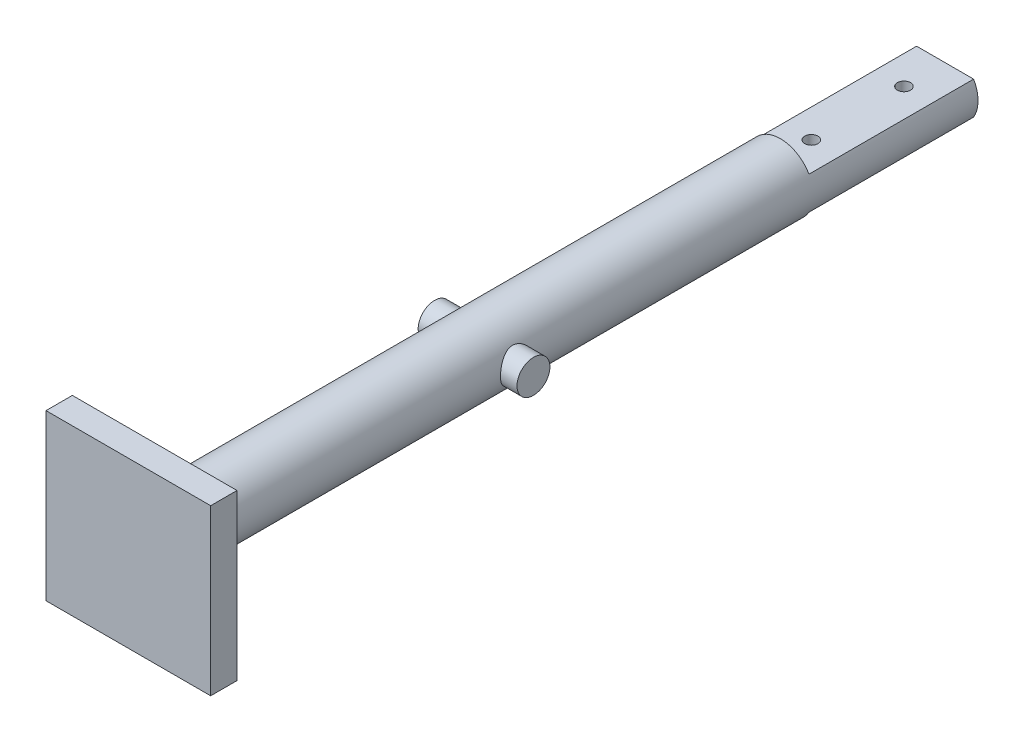
from build123d import *

# Parameters (mm, degrees)
SKETCH1_R           = 12.7
BOSS_EXTRUDE3_DEPTH = 152.4
SKETCH12_W          = 63.5
SKETCH12_H          = 63.5
BOSS_EXTRUDE5_DEPTH = 10.16
SKETCH9_R           = 6.35
BOSS_EXTRUDE6_DEPTH = 19.05
SKETCH16_W          = 25.4
SKETCH16_H          = 63.5
CUT_EXTRUDE2_DEPTH  = 170.957130183
SKETCH17_W          = 25.4
SKETCH17_H          = 63.5
CUT_EXTRUDE3_DEPTH  = 170.957130183
SKETCH19_R          = 2.54
CUT_EXTRUDE5_DEPTH  = 170.957130183


with BuildPart() as part:
    # Sketch1 → Boss-Extrude3 (new, symmetric)
    with BuildSketch(Plane.XY):
        with Locations(Location((0, 0, 0), (0, 0, 180))):
            Circle(SKETCH1_R)
    extrude(amount=BOSS_EXTRUDE3_DEPTH, both=True)

    # Sketch12 → Boss-Extrude5 (add)
    with BuildSketch(Plane.XY.offset(152.4)):
        Rectangle(SKETCH12_W, SKETCH12_H)
    extrude(amount=BOSS_EXTRUDE5_DEPTH)

    # Sketch9 → Boss-Extrude6 (add, symmetric)
    with BuildSketch(Plane(origin=(0, 0, 0), x_dir=(0, 0, -1), z_dir=(1, 0, 0))):
        with Locations((-25.4, 0)):
            Circle(SKETCH9_R)
    extrude(amount=BOSS_EXTRUDE6_DEPTH, both=True)

    # Sketch16 → Cut-Extrude2 (cut, through all)
    with BuildSketch(Plane(origin=(0, -6.35, 0), x_dir=(1, 0, 0), z_dir=(0, 1, 0))):
        with Locations((0, 120.65)):
            Rectangle(SKETCH16_W, SKETCH16_H)
    extrude(amount=-CUT_EXTRUDE2_DEPTH, mode=Mode.SUBTRACT)

    # Sketch17 → Cut-Extrude3 (cut, through all)
    with BuildSketch(Plane(origin=(0, 6.35, 0), x_dir=(1, 0, 0), z_dir=(0, 1, 0))):
        with Locations((0, 120.65)):
            Rectangle(SKETCH17_W, SKETCH17_H)
    extrude(amount=CUT_EXTRUDE3_DEPTH, mode=Mode.SUBTRACT)

    # Sketch19 → Cut-Extrude5 (cut, through all)
    with BuildSketch(Plane(origin=(0, 6.35, 0), x_dir=(1, 0, 0), z_dir=(0, 1, 0))):
        with Locations(Location((0, 100.80625, 0), (0, 0, 270))):
            Circle(SKETCH19_R)
        with Locations(Location((0, 136.525, 0), (0, 0, 270))):
            Circle(SKETCH19_R)
    extrude(amount=-CUT_EXTRUDE5_DEPTH, mode=Mode.SUBTRACT)


solid = part.part
